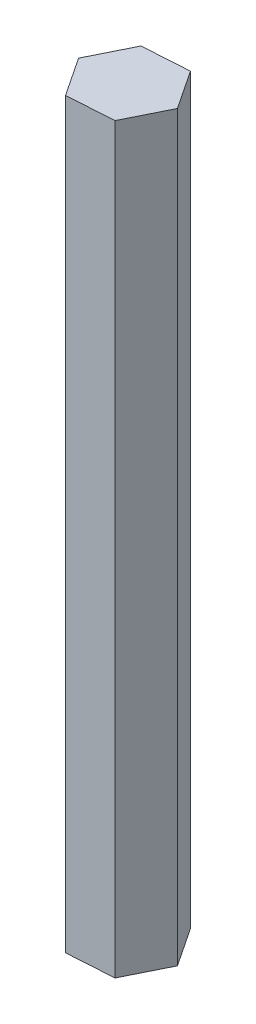
from build123d import *

# Parameters (mm, degrees)
BOSS_EXTRUDE1_DEPTH = 116.84


with BuildPart() as part:
    # Sketch1 → Boss-Extrude1 (new body)
    with BuildSketch(Plane(origin=(0, 0, 0), x_dir=(1, 0, 0), z_dir=(0, 1, 0))):
        Polygon((3.259935789, 6.567811811), (-4.057923981, 6.107093114), (-7.31785977, -0.460718697), (-3.259935789, -6.567811811), (4.057923981, -6.107093114), (7.31785977, 0.460718697), align=None)
    extrude(amount=BOSS_EXTRUDE1_DEPTH)


solid = part.part
